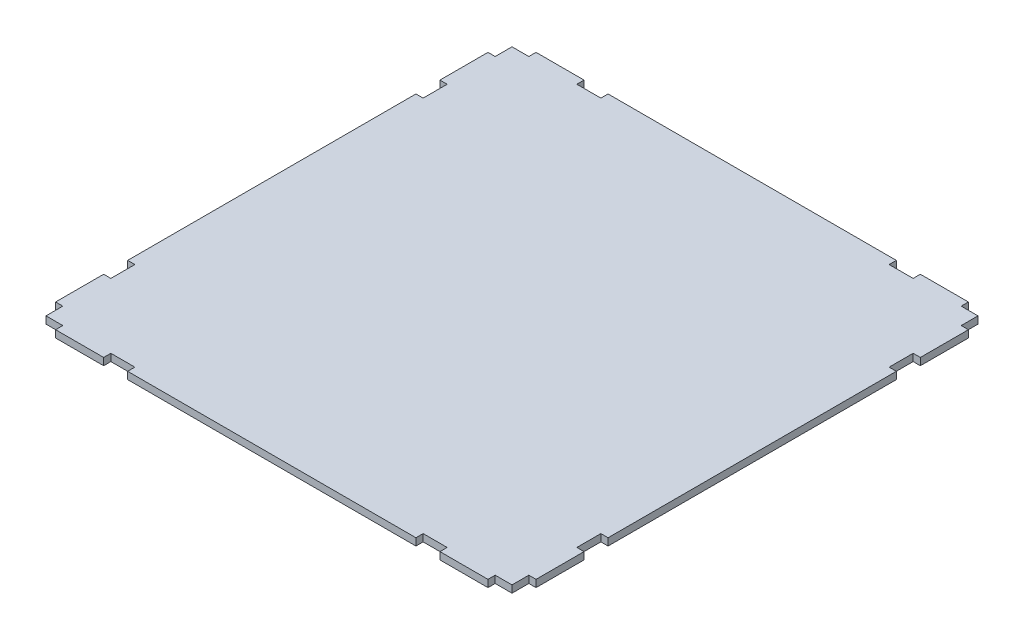
from build123d import *

# Parameters (mm, degrees)
BOSS_EXTRUDE1_DEPTH = 3


with BuildPart() as part:
    # Sketch1 → Boss-Extrude1 (new body)
    with BuildSketch(Plane(origin=(0, 0, 0), x_dir=(1, 0, 0), z_dir=(0, 1, 0))):
        Polygon((-100, 60), (-100, -60), (-97, -60), (-97, -70), (-100, -70), (-100, -90), (-97, -90), (-97, -97), (-90, -97), (-90, -100), (-70, -100), (-70, -97), (-60, -97), (-60, -100), (60, -100), (60, -97), (70, -97), (70, -100), (90, -100), (90, -97), (97, -97), (97, -90), (100, -90), (100, -70), (97, -70), (97, -60), (100, -60), (100, 60), (97, 60), (97, 70), (100, 70), (100, 90), (97, 90), (97, 97), (90, 97), (90, 100), (70, 100), (70, 97), (60, 97), (60, 100), (-60, 100), (-60, 97), (-70, 97), (-70, 100), (-90, 100), (-90, 97), (-97, 97), (-97, 90), (-100, 90), (-100, 70), (-97, 70), (-97, 60), align=None)
    extrude(amount=BOSS_EXTRUDE1_DEPTH)


solid = part.part
